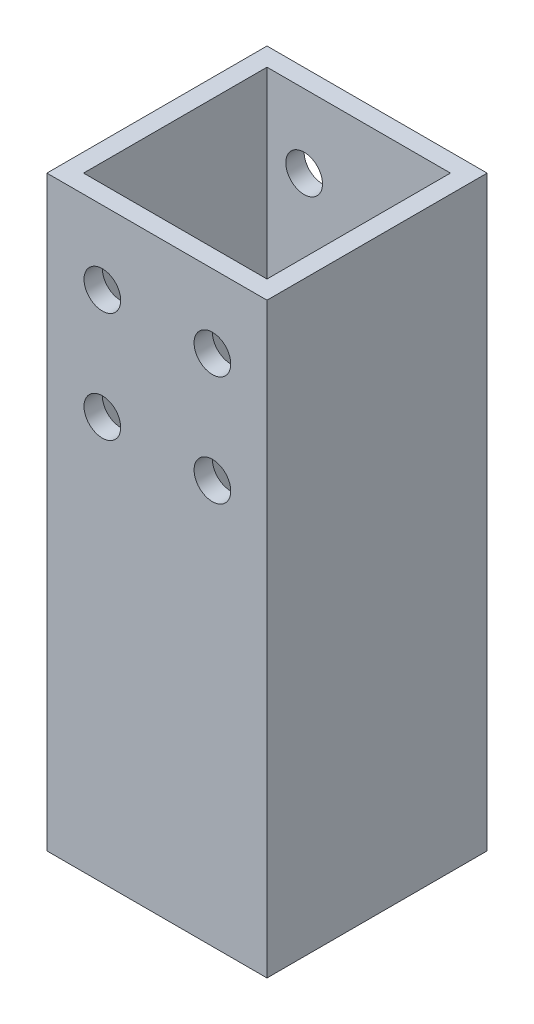
from build123d import *

# Parameters (mm, degrees)
SKETCH1_W            = 38.1
SKETCH1_H            = 38.1
SKETCH1_W_2          = 31.75
SKETCH1_H_2          = 31.75
BOSS_EXTRUDE1_DEPTH  = 101.6
SKETCH2_R            = 3.175
CUT_EXTRUDE1_DEPTH   = 101.6
LPATTERN1_COUNT      = 2
LPATTERN1_PITCH      = 19.05
LPATTERN1_COUNT_DIR2 = 2
LPATTERN1_PITCH_DIR2 = 19.05


with BuildPart() as part:
    # Sketch1 → Boss-Extrude1 (new body)
    with BuildSketch(Plane(origin=(0, 0, 0), x_dir=(1, 0, 0), z_dir=(0, 1, 0))):
        Rectangle(SKETCH1_W, SKETCH1_H)
        Rectangle(SKETCH1_W_2, SKETCH1_H_2, mode=Mode.SUBTRACT)
    extrude(amount=BOSS_EXTRUDE1_DEPTH)

    # Sketch2 → Cut-Extrude1 (cut)
    with BuildSketch(Plane.XY.offset(19.05)):
        with Locations((-9.4488, 69.85)):
            Circle(SKETCH2_R)
    cut_extrude1 = extrude(amount=-CUT_EXTRUDE1_DEPTH, mode=Mode.SUBTRACT)

    # LPattern1: Cut-Extrude1 2 × 2
    with Locations(*[(i * LPATTERN1_PITCH, j * LPATTERN1_PITCH_DIR2, 0) for i in range(LPATTERN1_COUNT) for j in range(LPATTERN1_COUNT_DIR2) if (i, j) != (0, 0)]):
        add(cut_extrude1, mode=Mode.SUBTRACT)


solid = part.part
